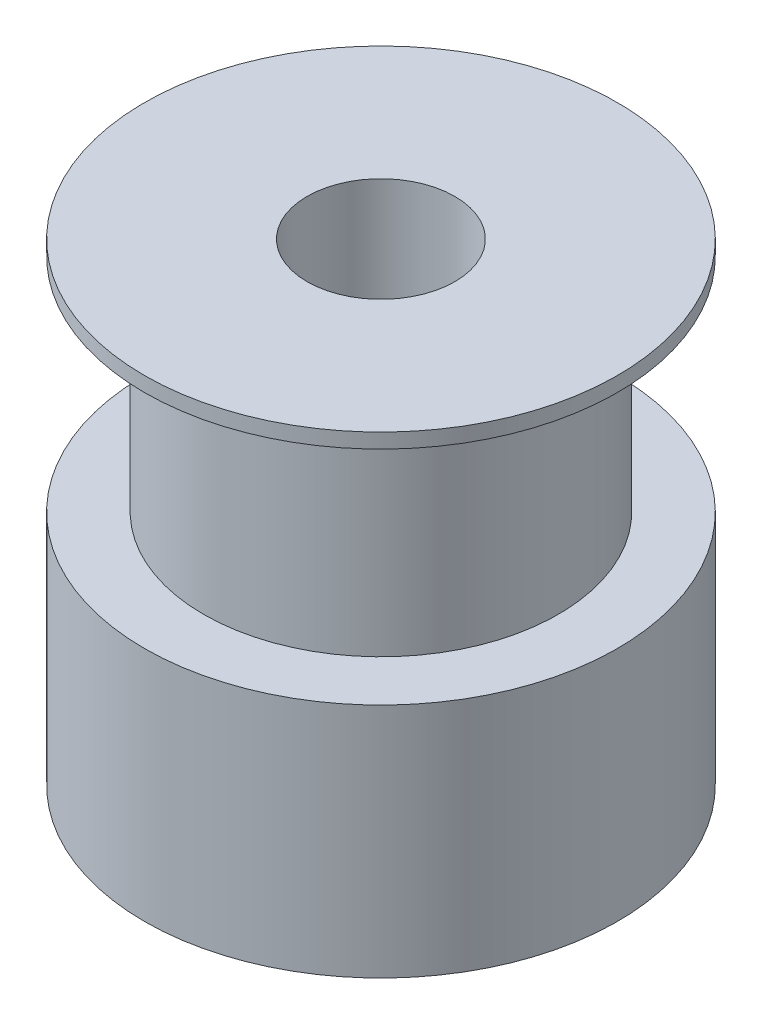
from build123d import *

# Parameters (mm, degrees)
SKETCH_1_R          = 8
EXTRUDE_1_DEPTH     = 8
SKETCH_2_R          = 6
EXTRUDE_2_DEPTH     = 7.5
SKETCH_3_R          = 8
EXTRUDE_3_DEPTH     = 0.5
CUT_EXTRUDE_1_REACH = 21.596
SKETCH_4_R          = 2.5


with BuildPart() as part:
    # 草图1 → 凸台-拉伸1 (new body)
    with BuildSketch(Plane(origin=(0, 0, 0), x_dir=(1, 0, 0), z_dir=(0, 1, 0))):
        with Locations(Location((0, 0, 0), (0, 0, 270))):
            Circle(SKETCH_1_R)
    extrude(amount=EXTRUDE_1_DEPTH)

    # 草图2 → 凸台-拉伸2 (add)
    with BuildSketch(Plane(origin=(0, 8, 0), x_dir=(1, 0, 0), z_dir=(0, 1, 0))):
        with Locations(Location((0, 0, 0), (0, 0, 270))):
            Circle(SKETCH_2_R)
    extrude(amount=EXTRUDE_2_DEPTH)

    # 草图3 → 凸台-拉伸3 (add)
    with BuildSketch(Plane(origin=(0, 15.5, 0), x_dir=(1, 0, 0), z_dir=(0, 1, 0))):
        with Locations(Location((0, 0, 0), (0, 0, 270))):
            Circle(SKETCH_3_R)
    extrude(amount=EXTRUDE_3_DEPTH)

    # 草图4 → 切除-拉伸1 (cut, up to next)
    with BuildSketch(Plane.XZ, mode=Mode.PRIVATE) as cut_extrude_1_sk1:
        with Locations(Location((0, 0, 0), (0, 0, 270))):
            Circle(SKETCH_4_R)
    cut_extrude_1_tool1 = extrude(cut_extrude_1_sk1.sketch, amount=-CUT_EXTRUDE_1_REACH, mode=Mode.PRIVATE) & part.part
    add(cut_extrude_1_tool1.solids().sort_by_distance((0, 0, 0))[0], mode=Mode.SUBTRACT)


solid = part.part
